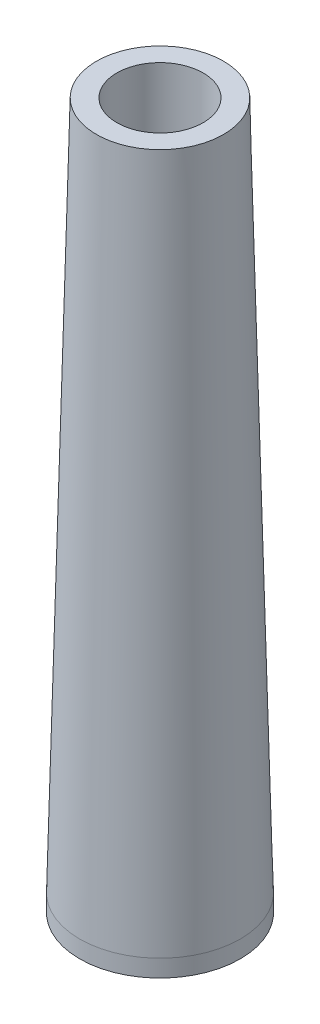
from build123d import *

# Parameters (mm, degrees)
CROQUIS1_R              = 14
SALIENTE_EXTRUIR1_DEPTH = 3
CROQUIS2_R              = 11.075
SALIENTE_EXTRUIR2_DEPTH = 120
CROQUIS3_R              = 7.525
CORTAR_EXTRUIR2_DEPTH   = 125.583305463


with BuildPart() as part:
    # Croquis1 → Saliente-Extruir1 (new body)
    with BuildSketch(Plane(origin=(0, 0, 0), x_dir=(1, 0, 0), z_dir=(0, 1, 0))):
        with Locations(Location((0, 0, 0), (0, 0, 270))):
            Circle(CROQUIS1_R)
    extrude(amount=SALIENTE_EXTRUIR1_DEPTH)

    # Croquis2 → Saliente-Extruir2 (add)
    with BuildSketch(Plane(origin=(0, 3, 0), x_dir=(1, 0, 0), z_dir=(0, 1, 0))):
        with Locations(Location((0, 0, 0), (0, 0, 270))):
            Circle(CROQUIS2_R)
    extrude(amount=SALIENTE_EXTRUIR2_DEPTH)

    # Croquis3 → Cortar-Extruir2 (cut, through all)
    with BuildSketch(Plane(origin=(0, 123, 0), x_dir=(1, 0, 0), z_dir=(0, 1, 0))):
        with Locations(Location((0, 0, 0), (0, 0, 270))):
            Circle(CROQUIS3_R)
    extrude(amount=-CORTAR_EXTRUIR2_DEPTH, mode=Mode.SUBTRACT)

    # Croquis4 → Revolución1 (revolve)
    with BuildSketch(Plane.XY, mode=Mode.PRIVATE) as revoluci_n1_sk:
        Polygon((14, 3), (11.075, 3), (11.075, 123), align=None)
    revolve(revoluci_n1_sk.sketch.rotate(Axis((0, 0, 0), (0, 1, 0)), 90), axis=Axis((0, 0, 0), (0, 1, 0)))


solid = part.part
